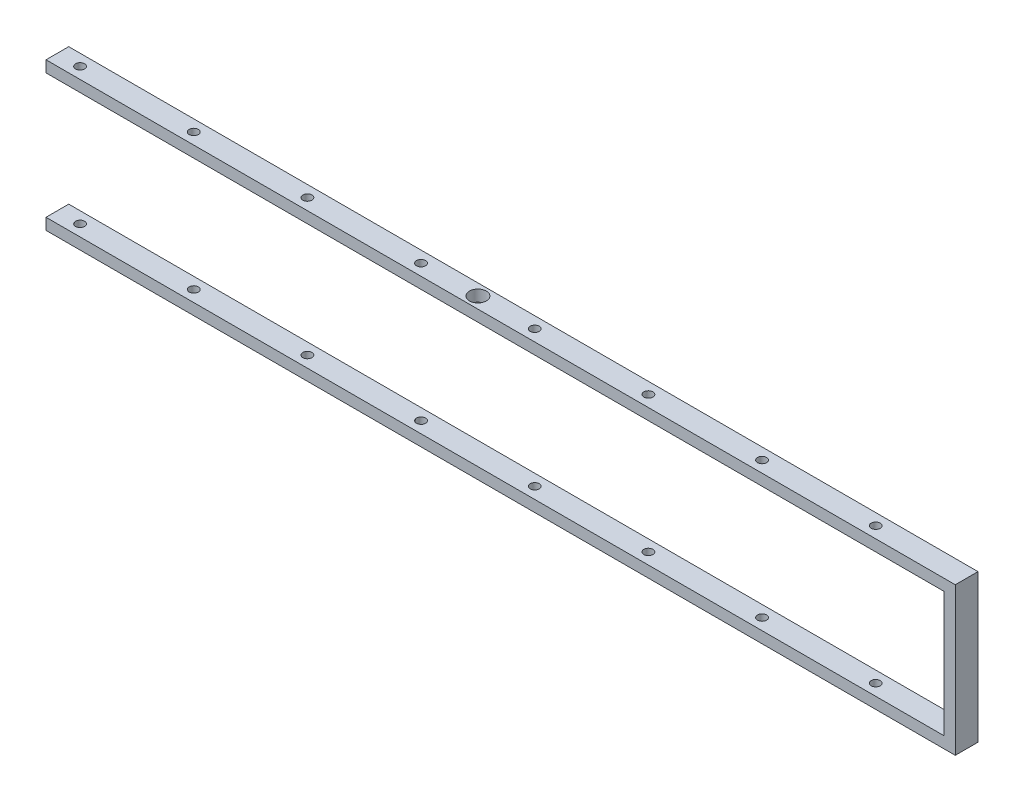
from build123d import *

# Parameters (mm, degrees)
BOSS_EXTRU_1_DEPTH         = 20
ESQUISSE2_R                = 4
ENL_V_MAT_EXTRU_1_DEPTH    = 811.740402348
R_P_TITION_LIN_AIRE1_COUNT = 8
R_P_TITION_LIN_AIRE1_PITCH = 100
ESQUISSE3_R                = 7.5
ENL_V_MAT_EXTRU_2_DEPTH    = 10


with BuildPart() as part:
    # Esquisse1 → Boss.-Extru.1 (new body)
    with BuildSketch(Plane.XY):
        Polygon((0, 130), (0, 120), (790, 120), (790, 10), (0, 10), (0, 0), (800, 0), (800, 130), align=None)
    extrude(amount=BOSS_EXTRU_1_DEPTH)

    # Esquisse2 → Enlèv. mat.-Extru.1 (cut, through all)
    with BuildSketch(Plane(origin=(0, 130, 0), x_dir=(1, 0, 0), z_dir=(0, 1, 0))):
        with Locations(Location((20, -10, 0), (0, 0, 270))):
            Circle(ESQUISSE2_R)
    enl_v_mat_extru_1 = extrude(amount=-ENL_V_MAT_EXTRU_1_DEPTH, mode=Mode.SUBTRACT)

    # Répétition linéaire1: Enlèv. mat.-Extru.1 ×8
    with Locations(*[(i * R_P_TITION_LIN_AIRE1_PITCH, 0, 0) for i in range(1, R_P_TITION_LIN_AIRE1_COUNT)]):
        add(enl_v_mat_extru_1, mode=Mode.SUBTRACT)

    # Esquisse3 → Enlèv. mat.-Extru.2 (cut)
    with BuildSketch(Plane(origin=(0, 130, 0), x_dir=(1, 0, 0), z_dir=(0, 1, 0))):
        with Locations(Location((370, -10, 0), (0, 0, 270))):
            Circle(ESQUISSE3_R)
    extrude(amount=-ENL_V_MAT_EXTRU_2_DEPTH, mode=Mode.SUBTRACT)


solid = part.part
